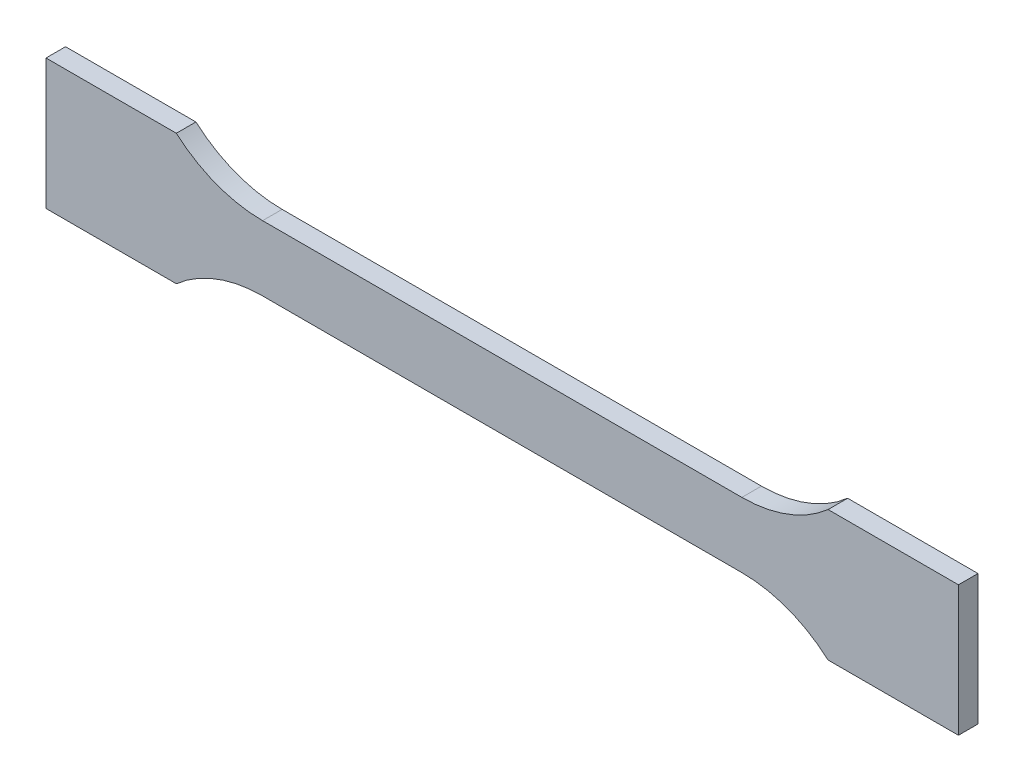
from build123d import *

# Parameters (mm, degrees)
BOSS_EXTRU_1_DEPTH = 3


with BuildPart() as part:
    # Esquisse1 → Boss.-Extru.1 (new body)
    with BuildSketch(Plane.XY):
        with BuildLine():
            Line((0, 20), (0, 0))
            Line((0, 0), (20, 0))
            ThreePointArc((20, 0), (26.157688743, 3.708286934), (33.228756555, 5))
            Line((33.228756555, 5), (70, 5))
            Line((70, 5), (70, 15))
            Line((70, 15), (33.228756555, 15))
            ThreePointArc((33.228756555, 15), (26.157688743, 16.291713066), (20, 20))
            Line((20, 20), (0, 20))
        make_face()
    boss_extru_1 = extrude(amount=BOSS_EXTRU_1_DEPTH)

    # Symétrie7: Boss.-Extru.1 across plane
    add(boss_extru_1.mirror(Plane(origin=(70, 15, 3), x_dir=(0, 0, 1), z_dir=(-1, 0, 0))))


solid = part.part
